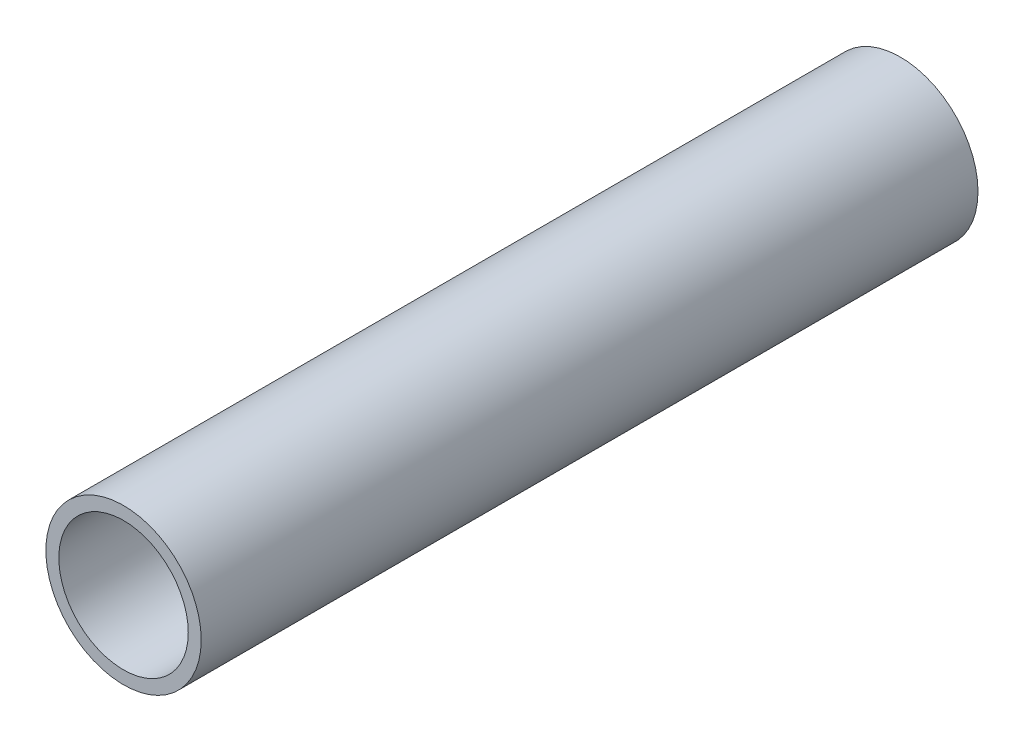
from build123d import *

# Parameters (mm, degrees)
SKETCH_1_R      = 6
SKETCH_1_R_2    = 5
EXTRUDE_1_DEPTH = 60


with BuildPart() as part:
    # 草图1 → 凸台-拉伸1 (new body)
    with BuildSketch(Plane.XY):
        Circle(SKETCH_1_R)
        Circle(SKETCH_1_R_2, mode=Mode.SUBTRACT)
    extrude(amount=EXTRUDE_1_DEPTH)


solid = part.part
